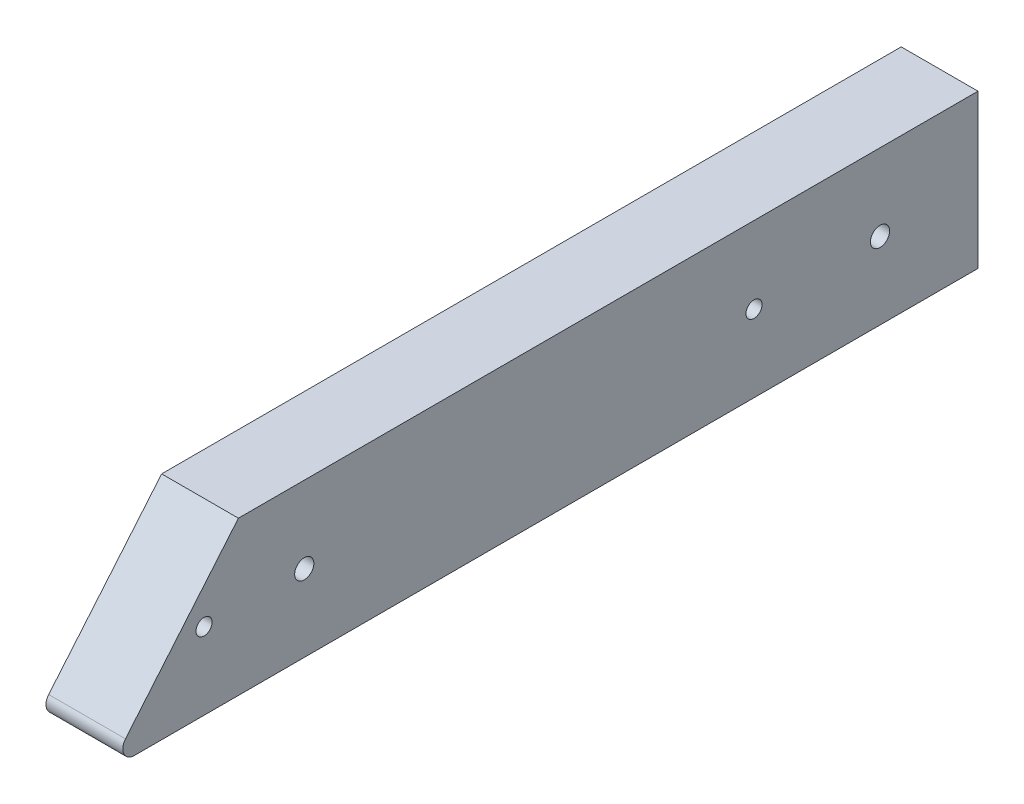
from build123d import *

# Parameters (mm, degrees)
BOSS_EXTRUDE1_DEPTH    = 20
M6_TAPPED_HOLE1_D      = 5
FILLET1_R              = 3
OTW_R_GWINTOWANY_M51_D = 4.2


with BuildPart() as part:
    # Sketch3 → Boss-Extrude1 (new body)
    with BuildSketch(Plane(origin=(0, 0, 0), x_dir=(0, 0, -1), z_dir=(1, 0, 0))):
        Polygon((-62.694317427, 20), (-96.258302674, -20), (130, -20), (130, 20), align=None)
    extrude(amount=BOSS_EXTRUDE1_DEPTH)

    # M6 Tapped Hole1 (through all)
    with Locations(Plane.ZY):
        with Locations((45.535720528, 0), (-104.464279472, 0)):
            Hole(M6_TAPPED_HOLE1_D / 2)

    # Fillet1
    fillet1_edges = [part.edges().sort_by_distance(p)[0] for p in [
        (10, -20, 96.258302674),
    ]]
    fillet(fillet1_edges, radius=FILLET1_R)

    # Otwór gwintowany M51 (through all)
    with Locations(Plane(origin=(20, 0, 0), x_dir=(0, 0, -1), z_dir=(1, 0, 0))):
        with Locations((-71.643866315, 0), (71.643866315, 0)):
            Hole(OTW_R_GWINTOWANY_M51_D / 2)


solid = part.part
